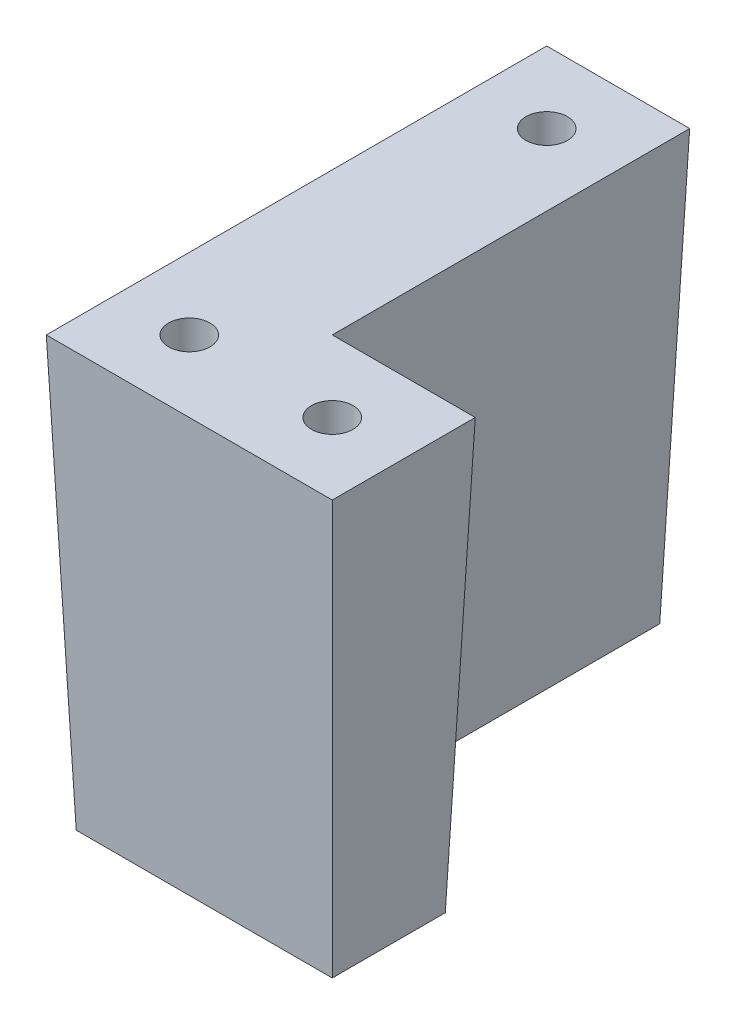
from build123d import *

# Parameters (mm, degrees)
BOSS_EXTRUDE1_DEPTH             = 60
BOSS_EXTRUDE1_DRAFT             = -2
CBORE_FOR_M5_SBHCS2_D           = 5.8
CBORE_FOR_M5_SBHCS2_CBORE_D     = 11.5
CBORE_FOR_M5_SBHCS2_CBORE_DEPTH = 55


with BuildPart() as part:
    # Sketch1 → Boss-Extrude1 (with draft: the straight prism first)
    with BuildSketch(Plane(origin=(0, 0, 0), x_dir=(1, 0, 0), z_dir=(0, 1, 0))):
        Polygon((0, 0), (40, 0), (40, 20), (20, 20), (20, 70), (0, 70), align=None)
    extrude(amount=-BOSS_EXTRUDE1_DEPTH)
    # Boss-Extrude1: the draft: its side faces are tilted about the plane it starts from
    boss_extrude1_sides = [part.faces().sort_by_distance(p)[0] for p in [
        (20, -30, 0),
        (40, -30, -10),
        (30, -30, -20),
        (20, -30, -45),
        (10, -30, -70),
        (0, -30, -35),
    ]]
    draft(boss_extrude1_sides, Plane(origin=(0, 0, 0), x_dir=(1, 0, 0), z_dir=(0, 1, 0)), BOSS_EXTRUDE1_DRAFT)

    # CBORE for M5 SBHCS2 (through all)
    with Locations(Plane(origin=(0, -60, 0), x_dir=(-1, 0, 0), z_dir=(0, -1, 0))):
        with Locations((-30, 10), (-10, 10), (-10.000000001, 60)):
            CounterBoreHole(CBORE_FOR_M5_SBHCS2_D / 2, CBORE_FOR_M5_SBHCS2_CBORE_D / 2, CBORE_FOR_M5_SBHCS2_CBORE_DEPTH)


solid = part.part
